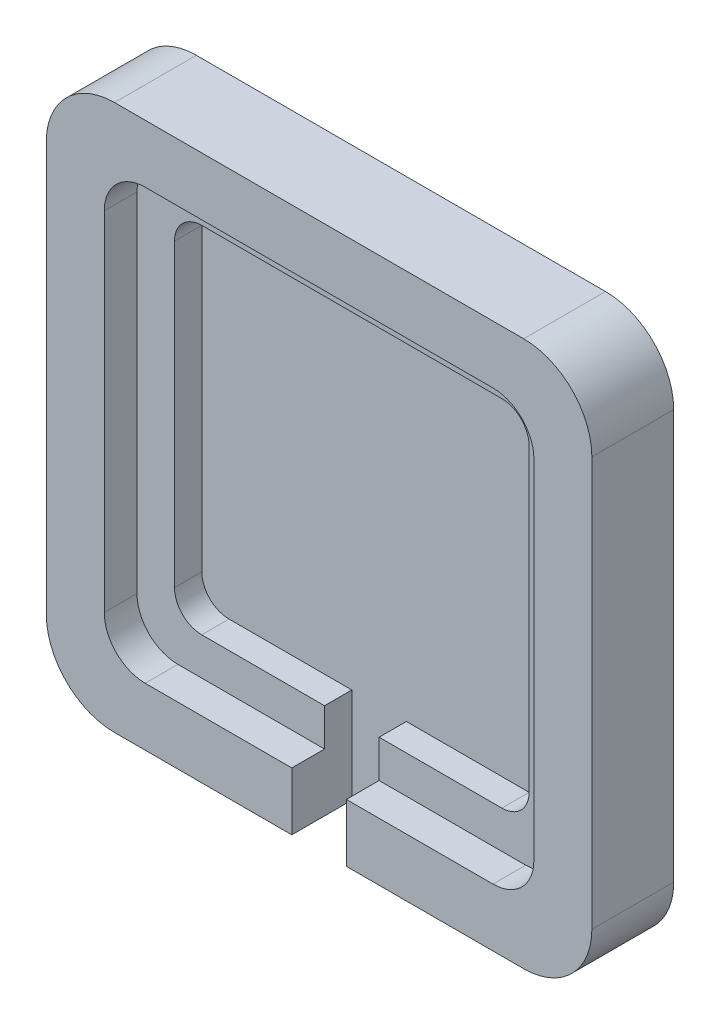
from build123d import *

# Parameters (mm, degrees)
SKIZZE1_W                       = 40
SKIZZE1_H                       = 40
AUFSATZ_LINEAR_AUSTRAGEN1_DEPTH = 6
VERRUNDUNG1_R                   = 5
SKIZZE2_W                       = 31.5
SKIZZE2_H                       = 31.5
SCHNITT_LINEAR_AUSTRAGEN1_DEPTH = 2.4
VERRUNDUNG2_R                   = 3
SKIZZE3_W                       = 26
SKIZZE3_H                       = 26
SCHNITT_LINEAR_AUSTRAGEN2_DEPTH = 2
VERRUNDUNG3_R                   = 2
SCHNITT_LINEAR_AUSTRAGEN3_REACH = 30.914
SKIZZE4_W                       = 4
SKIZZE4_H                       = 10.038850157


with BuildPart() as part:
    # Skizze1 → Aufsatz-Linear austragen1 (new body)
    with BuildSketch(Plane.XY):
        Rectangle(SKIZZE1_W, SKIZZE1_H)
    extrude(amount=AUFSATZ_LINEAR_AUSTRAGEN1_DEPTH)

    # Verrundung1
    verrundung1_edges = [part.edges().sort_by_distance(p)[0] for p in [
        (-20, 20, 3),
        (20, 20, 3),
        (20, -20, 3),
        (-20, -20, 3),
    ]]
    fillet(verrundung1_edges, radius=VERRUNDUNG1_R)

    # Skizze2 → Schnitt-Linear austragen1 (cut)
    with BuildSketch(Plane.XY.offset(6)):
        Rectangle(SKIZZE2_W, SKIZZE2_H)
    extrude(amount=-SCHNITT_LINEAR_AUSTRAGEN1_DEPTH, mode=Mode.SUBTRACT)

    # Verrundung2
    verrundung2_edges = [part.edges().sort_by_distance(p)[0] for p in [
        (-15.75, -15.75, 4.8),
        (-15.75, 15.75, 4.8),
        (15.75, 15.75, 4.8),
        (15.75, -15.75, 4.8),
    ]]
    fillet(verrundung2_edges, radius=VERRUNDUNG2_R)

    # Skizze3 → Schnitt-Linear austragen2 (cut)
    with BuildSketch(Plane.XY.offset(3.6)):
        Rectangle(SKIZZE3_W, SKIZZE3_H)
    extrude(amount=-SCHNITT_LINEAR_AUSTRAGEN2_DEPTH, mode=Mode.SUBTRACT)

    # Verrundung3
    verrundung3_edges = [part.edges().sort_by_distance(p)[0] for p in [
        (13, 13, 2.6),
        (13, -13, 2.6),
        (-13, -13, 2.6),
        (-13, 13, 2.6),
    ]]
    fillet(verrundung3_edges, radius=VERRUNDUNG3_R)

    # Schnitt-Linear austragen3: up to this face of the body (flat: up to its plane)
    schnitt_linear_austragen3_end = Plane(part.part.faces().sort_by_distance((0, 0, 1.6))[0])
    # Skizze4 → Schnitt-Linear austragen3 (cut, up to the picked face)
    with BuildSketch(Plane.XY.offset(6), mode=Mode.PRIVATE) as schnitt_linear_austragen3_sk1:
        with Locations((0, -17.296929977)):
            Rectangle(SKIZZE4_W, SKIZZE4_H)
    schnitt_linear_austragen3_tool1 = split(extrude(schnitt_linear_austragen3_sk1.sketch, amount=-SCHNITT_LINEAR_AUSTRAGEN3_REACH, mode=Mode.PRIVATE), bisect_by=schnitt_linear_austragen3_end, keep=Keep.BOTH, mode=Mode.PRIVATE)
    add(schnitt_linear_austragen3_tool1.solids().sort_by(Axis((0, -17.29693, 6), (0, 0, -1)))[0], mode=Mode.SUBTRACT)


solid = part.part
